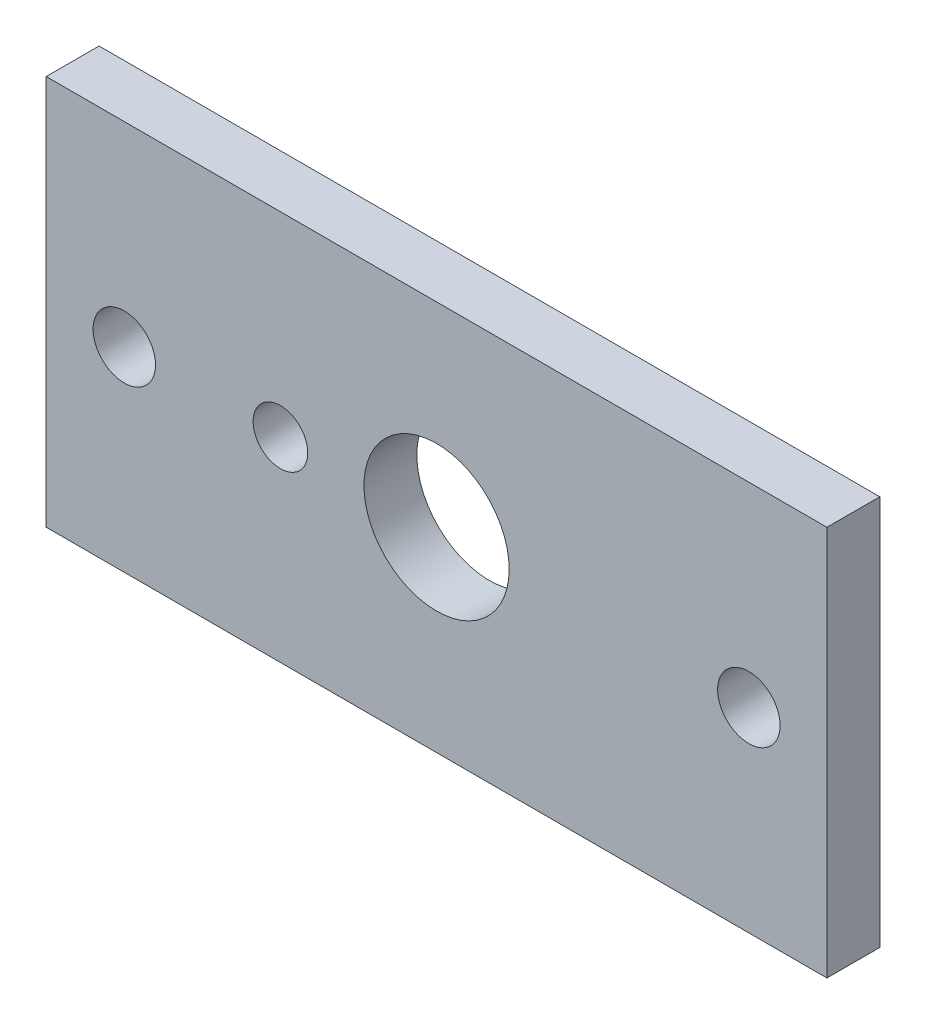
from build123d import *

# Parameters (mm, degrees)
SKETCH1_W           = 50
SKETCH1_H           = 25
SKETCH1_R           = 4.65
SKETCH1_R_2         = 1.75
SKETCH1_R_3         = 2
BOSS_EXTRUDE1_DEPTH = 3.385


with BuildPart() as part:
    # Sketch1 → Boss-Extrude1 (new body)
    with BuildSketch(Plane.XY):
        Rectangle(SKETCH1_W, SKETCH1_H)
        Circle(SKETCH1_R, mode=Mode.SUBTRACT)
        with Locations((-10, 0)):
            Circle(SKETCH1_R_2, mode=Mode.SUBTRACT)
        with Locations((20, 0)):
            Circle(SKETCH1_R_3, mode=Mode.SUBTRACT)
        with Locations((-20, 0)):
            Circle(SKETCH1_R_3, mode=Mode.SUBTRACT)
    extrude(amount=BOSS_EXTRUDE1_DEPTH)


solid = part.part
